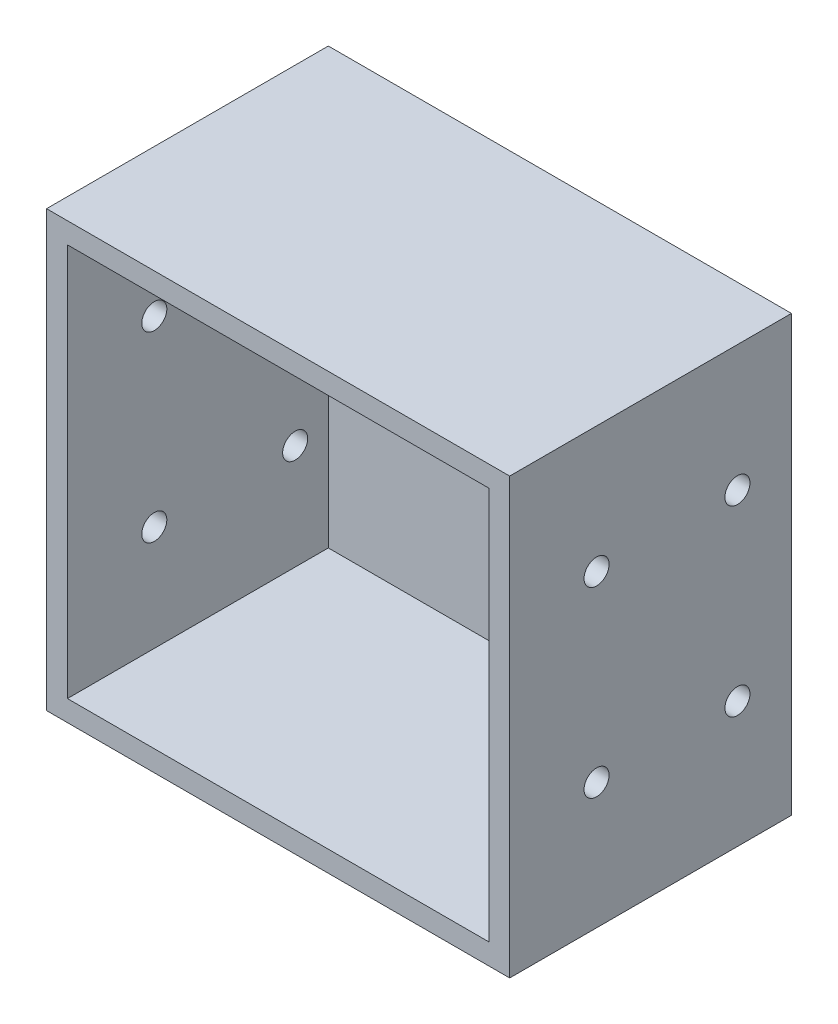
from build123d import *

# Parameters (mm, degrees)
SKETCH1_W            = 80.762
SKETCH1_H            = 75.312
BOSS_EXTRUDE1_DEPTH  = 50
SHELL1_T             = 4
M4_CLEARANCE_HOLE1_D = 4.8


with BuildPart() as part:
    # Sketch1 → Boss-Extrude1 (new body)
    with BuildSketch(Plane.XY):
        Rectangle(SKETCH1_W, SKETCH1_H)
    extrude(amount=BOSS_EXTRUDE1_DEPTH)

    # Shell1
    shell1_openings = [part.faces().sort_by_distance(p)[0] for p in [
        (0, 0, 50),
    ]]
    offset(amount=SHELL1_T, openings=shell1_openings, kind=Kind.INTERSECTION)

    # M4 Clearance Hole1 (through all)
    with Locations(Plane(origin=(44.381, 0, 0), x_dir=(0, 0, -1), z_dir=(1, 0, 0))):
        with Locations((-33.35, -17.5), (-6.35, -17.5), (-33.35, 17.5), (-6.35, 17.5)):
            Hole(M4_CLEARANCE_HOLE1_D / 2)


solid = part.part
